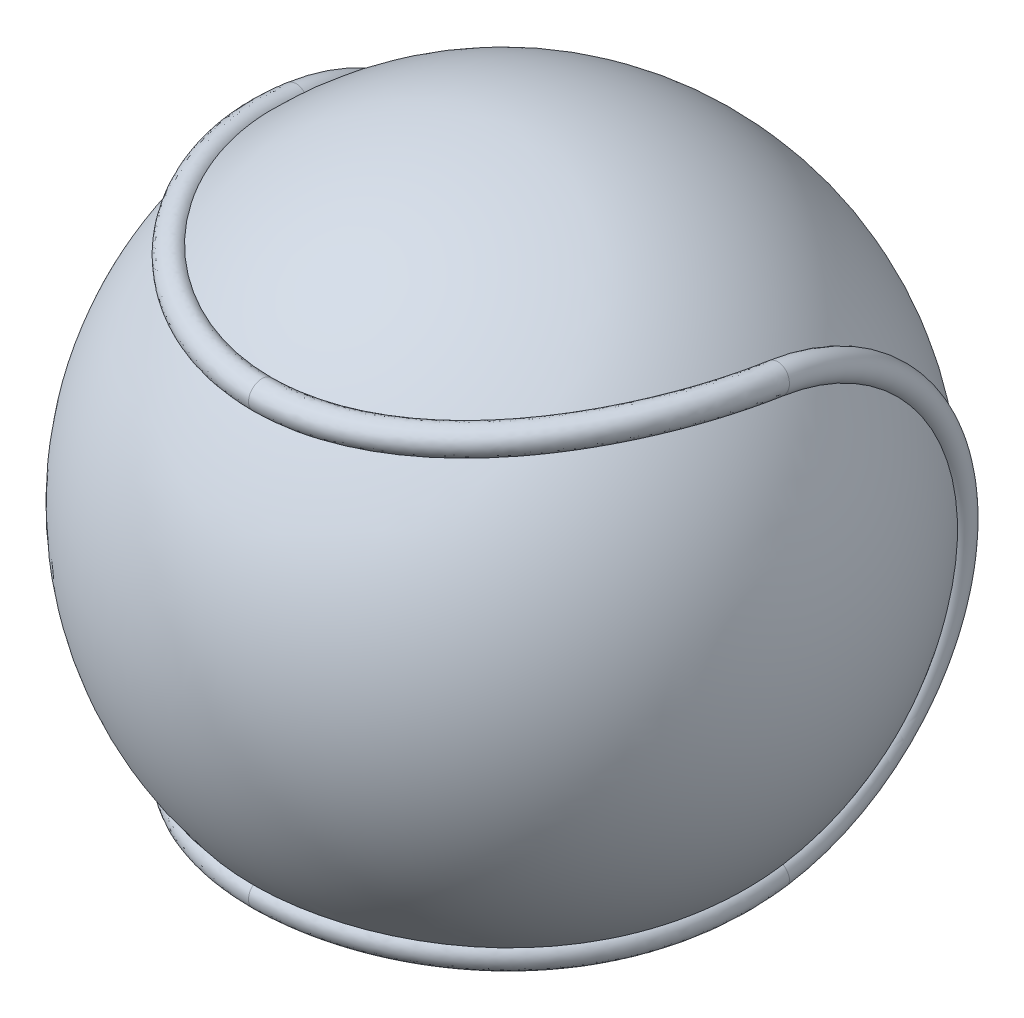
from build123d import *

# Parameters (mm, degrees)
SKETCH3_R   = 3.175
SKETCH3_2_R = 3.175


with BuildPart() as part:
    # Sketch1 → Revolve1 (revolve)
    with BuildSketch(Plane.XY):
        with BuildLine():
            Line((-76.2, 0), (76.2, 0))
            ThreePointArc((76.2, 0), (0, 76.2), (-76.2, 0))
        make_face()
    revolve(axis=Axis((-76.2, 0, 0), (1, 0, 0)))

    # Sweep1: sweep along a curve in space
    with BuildLine() as sweep1_path:
        add(Edge.make_bspline(
            [(0, -50.8, 56.796126628), (4.016711809, -50.8, 56.796126628), (7.945904922, -50.865113562, 56.318001754), (15.640195173, -51.100534074, 54.463145489), (19.438766995, -51.273575322, 53.059543769), (26.514867734, -51.659877686, 49.501305034), (29.835238093, -51.873661058, 47.344534559), (36.059063552, -52.276802337, 42.301335315), (38.862236314, -52.459002082, 39.496370116), (43.912213597, -52.722260775, 33.380597341), (46.171480509, -52.802789745, 30.037527524), (50.010689288, -52.801460445, 23.089608245), (51.611143701, -52.721664554, 19.468336308), (53.553813118, -52.452293193, 13.825739976), (54.125592191, -52.336885144, 11.902794241), (55.097874696, -52.055899845, 8.050669705), (55.501119627, -51.890187234, 6.115215769), (56.46971134, -51.314898955, 0.282039293), (56.796126628, -50.827300193, -3.642189753), (56.796126628, -50.227963063, -7.602086985)],
            knots=[0, 0, 0, 0, 0.125, 0.125, 0.25, 0.25, 0.375, 0.375, 0.5, 0.5, 0.625, 0.625, 0.75, 0.75, 0.8125, 0.8125, 0.875, 0.875, 1, 1, 1, 1], degree=3))
        ThreePointArc((56.796126628, -50.227963063, -7.602086985), (56.796126628, 0, -50.8), (56.796126628, 50.227963063, -7.602086985))
        add(Edge.make_bspline(
            [(56.796126628, 50.227963063, -7.602086985), (56.796126628, 50.828032157, -3.637353572), (56.468931965, 51.315337765, 0.286571833), (55.179193161, 52.0814173, 8.054123454), (54.211042198, 52.360838709, 11.914433211), (51.610202928, 52.722116743, 19.473407642), (50.007306252, 52.801312197, 23.094352335), (47.141130515, 52.802528402, 28.283412059), (46.108250278, 52.783290035, 29.97243403), (43.879257173, 52.711099521, 33.264756569), (42.675331705, 52.657693383, 34.877062203), (38.865906763, 52.459367363, 39.49481451), (36.071690737, 52.277632029, 42.283827938), (31.479768425, 51.980177955, 46.015488987), (29.881903585, 51.876832515, 47.183548264), (26.541941186, 51.669879931, 49.357572938), (24.794235781, 51.566076059, 50.364514131), (19.470351812, 51.27504023, 53.047621025), (15.770658046, 51.105672264, 54.421687204), (8.054253793, 50.867317194, 56.301584953), (4.02532077, 50.8, 56.796126628), (0, 50.8, 56.796126628)],
            knots=[0, 0, 0, 0, 0.125, 0.125, 0.25, 0.25, 0.375, 0.375, 0.4375, 0.4375, 0.5, 0.5, 0.625, 0.625, 0.6875, 0.6875, 0.75, 0.75, 0.875, 0.875, 1, 1, 1, 1], degree=3))
    # Sketch3 → Sweep1 (sweep)
    with BuildSketch(Plane(origin=(0, 0, 0), x_dir=(0, 0, -1), z_dir=(1, 0, 0))):
        with Locations((-56.796126628, 50.8)):
            Circle(SKETCH3_R)
    sweep(path=sweep1_path.line)

    # Sweep2: sweep along a curve in space
    with BuildLine() as sweep2_path:
        add(Edge.make_bspline(
            [(0, 50.8, 56.796126628), (-4.02532077, 50.8, 56.796126628), (-8.054253793, 50.867317194, 56.301584953), (-15.770658046, 51.105672264, 54.421687204), (-19.470351812, 51.27504023, 53.047621025), (-24.794235781, 51.566076059, 50.364514131), (-26.541941186, 51.669879931, 49.357572938), (-29.881903585, 51.876832515, 47.183548264), (-31.479768425, 51.980177955, 46.015488987), (-36.071690737, 52.277632029, 42.283827938), (-38.865906763, 52.459367363, 39.49481451), (-42.675331705, 52.657693383, 34.877062203), (-43.879257173, 52.711099521, 33.264756569), (-46.108250278, 52.783290035, 29.97243403), (-47.141130515, 52.802528402, 28.283412059), (-50.007306252, 52.801312197, 23.094352335), (-51.610202928, 52.722116743, 19.473407642), (-54.211042198, 52.360838709, 11.914433211), (-55.179193161, 52.0814173, 8.054123454), (-56.468931965, 51.315337765, 0.286571833), (-56.796126628, 50.828032157, -3.637353572), (-56.796126628, 50.227963063, -7.602086985)],
            knots=[0, 0, 0, 0, 0.125, 0.125, 0.25, 0.25, 0.3125, 0.3125, 0.375, 0.375, 0.5, 0.5, 0.5625, 0.5625, 0.625, 0.625, 0.75, 0.75, 0.875, 0.875, 1, 1, 1, 1], degree=3))
        ThreePointArc((-56.796126628, 50.227963063, -7.602086985), (-56.796126628, 0, -50.8), (-56.796126628, -50.227963063, -7.602086985))
        add(Edge.make_bspline(
            [(-56.796126628, -50.227963063, -7.602086985), (-56.796126628, -50.827300193, -3.642189753), (-56.46971134, -51.314898955, 0.282039293), (-55.501119627, -51.890187234, 6.115215769), (-55.097874696, -52.055899845, 8.050669705), (-54.125592191, -52.336885144, 11.902794241), (-53.553813118, -52.452293193, 13.825739976), (-51.611143701, -52.721664554, 19.468336308), (-50.010689288, -52.801460445, 23.089608245), (-46.171480509, -52.802789745, 30.037527524), (-43.912213597, -52.722260775, 33.380597341), (-38.862236314, -52.459002082, 39.496370116), (-36.059063552, -52.276802337, 42.301335315), (-29.835238093, -51.873661058, 47.344534559), (-26.514867734, -51.659877686, 49.501305034), (-19.438766995, -51.273575322, 53.059543769), (-15.640195173, -51.100534074, 54.463145489), (-7.945904922, -50.865113562, 56.318001754), (-4.016711809, -50.8, 56.796126628), (0, -50.8, 56.796126628)],
            knots=[0, 0, 0, 0, 0.125, 0.125, 0.1875, 0.1875, 0.25, 0.25, 0.375, 0.375, 0.5, 0.5, 0.625, 0.625, 0.75, 0.75, 0.875, 0.875, 1, 1, 1, 1], degree=3))
    # Sketch3<2> → Sweep2 (sweep)
    with BuildSketch(Plane(origin=(0, 0, 0), x_dir=(0, 0, -1), z_dir=(1, 0, 0))):
        with Locations((-56.796126628, 50.8)):
            Circle(SKETCH3_2_R)
    sweep(path=sweep2_path.line)


solid = part.part
